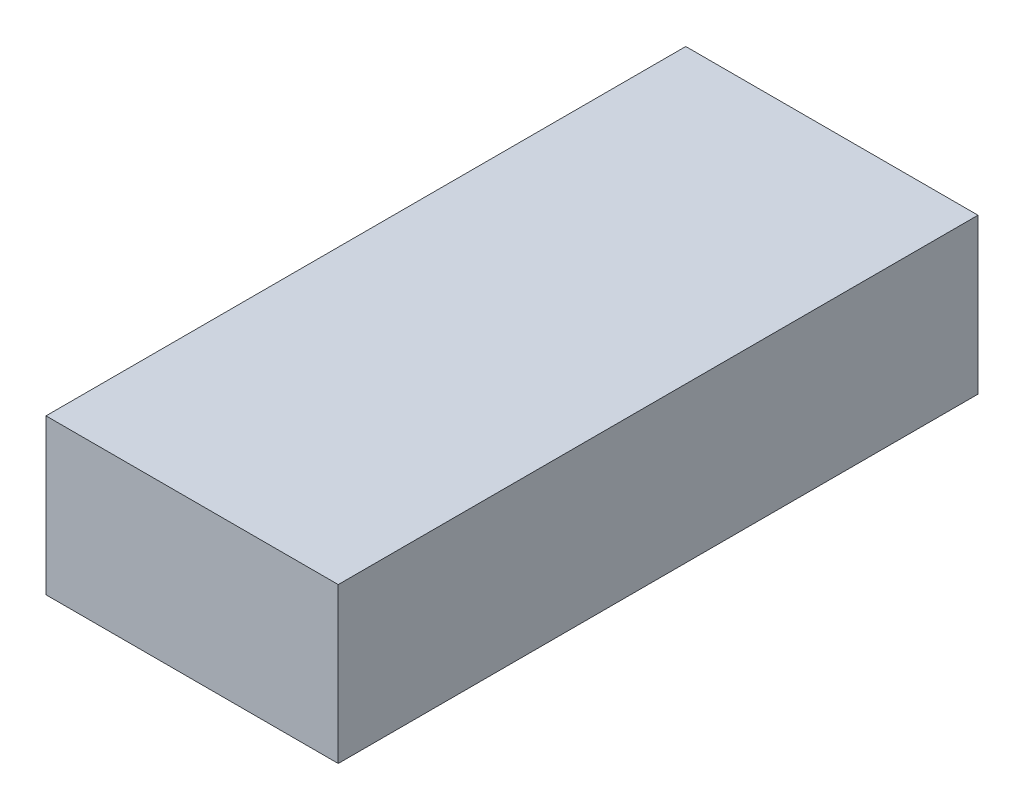
from build123d import *

# Parameters (mm, degrees)
SKETCH1_W           = 42.56
SKETCH1_H           = 93.17
BOSS_EXTRUDE1_DEPTH = 22.57


with BuildPart() as part:
    # Sketch1 → Boss-Extrude1 (new body)
    with BuildSketch(Plane(origin=(0, 0, 0), x_dir=(1, 0, 0), z_dir=(0, 1, 0))):
        Rectangle(SKETCH1_W, SKETCH1_H)
    extrude(amount=BOSS_EXTRUDE1_DEPTH)


solid = part.part
